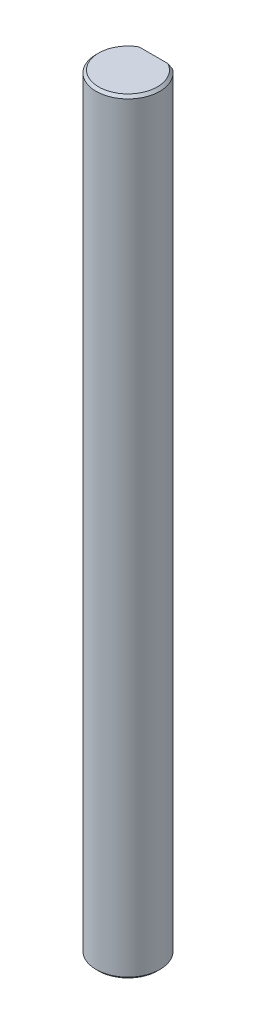
from build123d import *

# Parameters (mm, degrees)
CROQUIS1_R              = 2.5
SALIENTE_EXTRUIR1_DEPTH = 60
CORTAR_EXTRUIR1_START   = -10
CORTAR_EXTRUIR1_DEPTH   = 10
CHAFL_N1_SIZE           = 0.2


with BuildPart() as part:
    # Croquis1 → Saliente-Extruir1 (new body)
    with BuildSketch(Plane(origin=(0, 0, 0), x_dir=(1, 0, 0), z_dir=(0, 1, 0))):
        with Locations(Location((0, 0, 0), (0, 0, 270))):
            Circle(CROQUIS1_R)
    extrude(amount=SALIENTE_EXTRUIR1_DEPTH)

    # Croquis2 → Cortar-Extruir1 (cut)
    with BuildSketch(Plane(origin=(0, 60, 0), x_dir=(1, 0, 0), z_dir=(0, 1, 0)).offset(CORTAR_EXTRUIR1_START)):
        with BuildLine():
            Line((-1.5, 2), (1.5, 2))
            ThreePointArc((1.5, 2), (0, 2.5), (-1.5, 2))
        make_face()
    extrude(amount=CORTAR_EXTRUIR1_DEPTH, mode=Mode.SUBTRACT)

    # Chaflán1
    chafl_n1_edges = [part.edges().sort_by_distance(p)[0] for p in [
        (0, 0, -2.5),
        (-2.371708245, 60, 0.790569415),
    ]]
    chamfer(chafl_n1_edges, length=CHAFL_N1_SIZE)


solid = part.part
